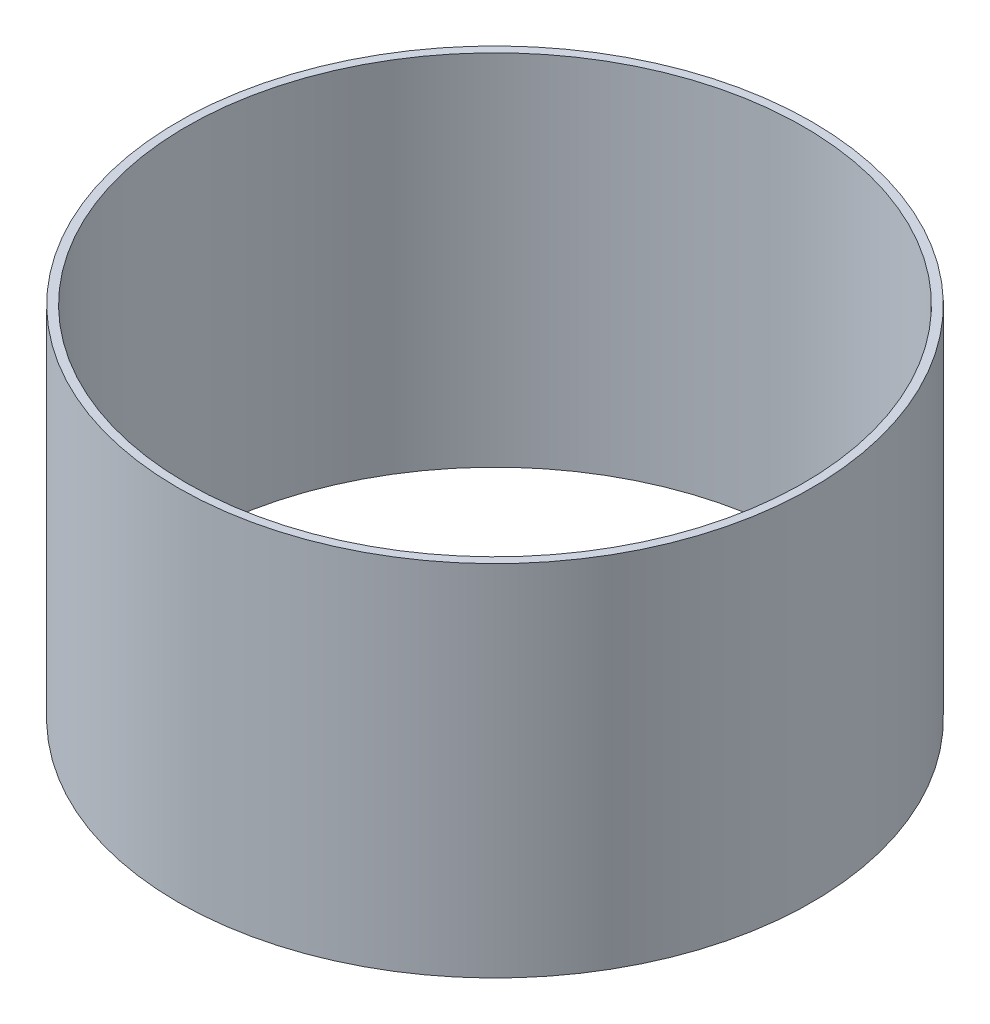
from build123d import *

# Parameters (mm, degrees)
SKETCH1_R           = 265
SKETCH1_R_2         = 258
BOSS_EXTRUDE1_DEPTH = 150


with BuildPart() as part:
    # Sketch1 → Boss-Extrude1 (new, symmetric)
    with BuildSketch(Plane(origin=(0, 0, 0), x_dir=(1, 0, 0), z_dir=(0, 1, 0))):
        with Locations(Location((0, 0, 0), (0, 0, 270))):
            Circle(SKETCH1_R)
        with Locations(Location((0, 0, 0), (0, 0, 270))):
            Circle(SKETCH1_R_2, mode=Mode.SUBTRACT)
    extrude(amount=BOSS_EXTRUDE1_DEPTH, both=True)


solid = part.part
